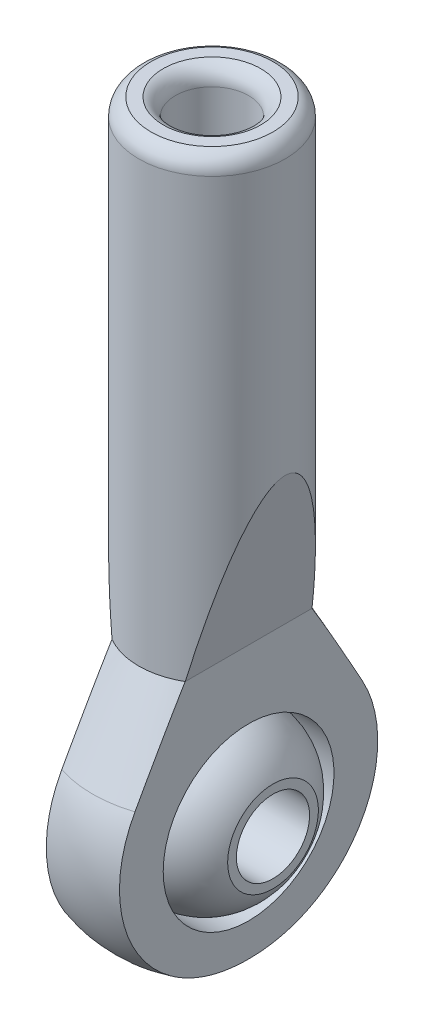
from build123d import *

# Parameters (mm, degrees)
CUT_EXTRUDE_1_DEPTH = 8
SKETCH_6_R          = 3.5
CUT_EXTRUDE_2_DEPTH = 16


with BuildPart() as part:
    # 草图1 → 旋转1 (revolve)
    with BuildSketch(Plane(origin=(0, 0, 0), x_dir=(0, 0, -1), z_dir=(1, 0, 0)), mode=Mode.PRIVATE) as revolve_1_sk:
        with BuildLine():
            Line((1.5, -0.707106781), (1.5, -10.707106781))
            Line((1.5, -10.707106781), (0, -10.707106781))
            Line((0, -10.707106781), (0, -30))
            ThreePointArc((0, -30), (4.679543251, -27.571142528), (4.894439657, -22.303192909))
            Line((4.894439657, -22.303192909), (3, -18.707106781))
            Line((3, -18.707106781), (3, -0.707106781))
            ThreePointArc((3, -0.707106781), (2.862372436, -0.274094079), (2.5, 0))
            Line((2.5, 0), (2, 0))
            ThreePointArc((2, 0), (1.637627564, -0.274094079), (1.5, -0.707106781))
        make_face()
    revolve(revolve_1_sk.sketch.rotate(Axis((0, 0, 0), (0, -1, 0)), 180), axis=Axis((0, 0, 0), (0, -1, 0)))

    # 草图5 → 切除-拉伸1 (cut, symmetric)
    with BuildSketch(Plane.XY):
        Polygon((-3, -11.940068736), (-1.5, -18.707106781), (-1.5, -33.687939327), (-8.726948797, -33.687939327), (-8.726948797, -11.940068736), align=None)
        Polygon((3, -11.940068736), (1.5, -18.707106781), (1.5, -33.687939327), (8.726948797, -33.687939327), (8.726948797, -11.940068736), align=None)
    extrude(amount=CUT_EXTRUDE_1_DEPTH, both=True, mode=Mode.SUBTRACT)

    # 草图6 → 切除-拉伸2 (cut)
    with BuildSketch(Plane.ZY.offset(1.5)):
        with Locations((0, -25)):
            Circle(SKETCH_6_R)
    extrude(amount=-CUT_EXTRUDE_2_DEPTH, mode=Mode.SUBTRACT)


with BuildPart() as body_2:
    # 草图7 → 旋转3 (revolve)
    with BuildSketch(Plane.XY, mode=Mode.PRIVATE) as revolve_3_sk:
        with BuildLine():
            Line((-2.5, -26.5), (2.5, -26.5))
            Line((2.5, -26.5), (2.5, -26.858504456))
            ThreePointArc((2.5, -26.858504456), (0, -28.432857223), (-2.5, -26.858504456))
            Line((-2.5, -26.858504456), (-2.5, -26.5))
        make_face()
    revolve(revolve_3_sk.sketch.rotate(Axis((-1.5, -25, 0), (1, 0, 0)), 270), axis=Axis((-1.5, -25, 0), (1, 0, 0)))


solid = Compound([part.part, body_2.part])
